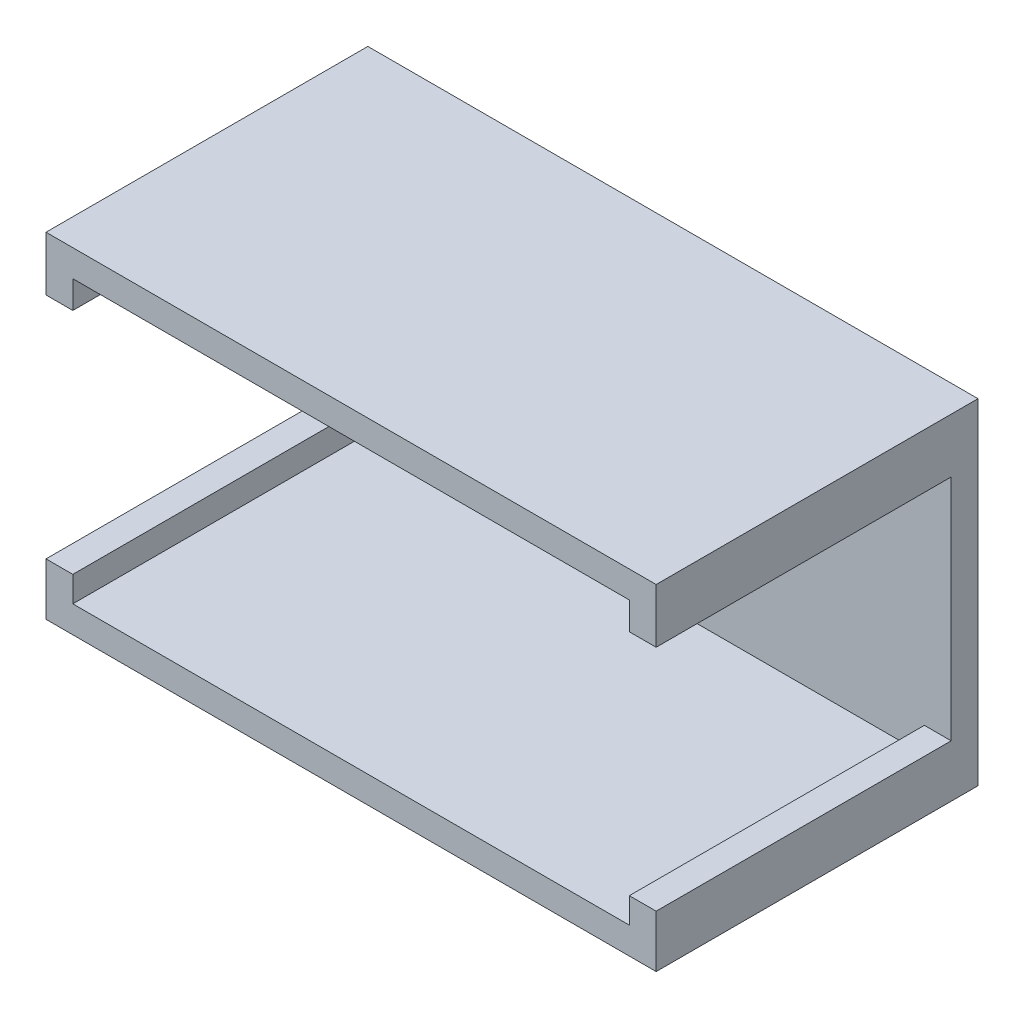
from build123d import *

# Parameters (mm, degrees)
SALIENTE_EXTRUIR1_DEPTH = 2
SALIENTE_EXTRUIR2_DEPTH = 24
CROQUIS4_W              = 26.838471133
CROQUIS4_H              = 17.040828642
CORTAR_EXTRUIR1_DEPTH   = 70.1
SALIENTE_EXTRUIR3_DEPTH = 2
SALIENTE_EXTRUIR4_DEPTH = 2
CROQUIS7_W              = 45.5
CROQUIS7_H              = 2
SALIENTE_EXTRUIR5_DEPTH = 8
SALIENTE_EXTRUIR6_DEPTH = 6
CROQUIS9_W              = 76.962380363
CROQUIS9_H              = 58.957858246
CORTAR_EXTRUIR2_DEPTH   = 28


with BuildPart() as part:
    # Croquis1 → Saliente-Extruir1 (new body)
    with BuildSketch(Plane.XY):
        Polygon((-48.939551095, 26.503456625), (-8.439551095, 26.503456625), (-4.439551095, 26.503456625), (-4.439551095, 1.503456625), (-8.439551095, 1.503456625), (-49.939551095, 1.503456625), (-49.939551095, 5.503456625), (-49.939551095, 26.503456625), align=None)
    extrude(amount=SALIENTE_EXTRUIR1_DEPTH)

    # Croquis3 → Saliente-Extruir2 (add)
    with BuildSketch(Plane.XY):
        Polygon((-48.939551095, 26.503456625), (-8.439551095, 26.503456625), (-4.439551095, 26.503456625), (-4.439551095, 1.503456625), (-49.939551095, 1.503456625), (-49.939551095, 26.503456625), align=None)
        Polygon((-10.439551095, 3.503456625), (-47.939551095, 3.503456625), (-47.939551095, 5.503456625), (-47.939551095, 24.503456625), (-10.439551095, 24.503456625), (-6.439551095, 24.503456625), (-6.439551095, 3.503456625), align=None, mode=Mode.SUBTRACT)
    extrude(amount=SALIENTE_EXTRUIR2_DEPTH)

    # Croquis4 → Cortar-Extruir1 (cut)
    with BuildSketch(Plane(origin=(0, 0, 0), x_dir=(0, 0, -1), z_dir=(1, 0, 0))):
        with Locations((-15.419235567, 13.92807924)):
            Rectangle(CROQUIS4_W, CROQUIS4_H)
    extrude(amount=-CORTAR_EXTRUIR1_DEPTH, mode=Mode.SUBTRACT)

    # Croquis5 → Saliente-Extruir3 (add)
    with BuildSketch(Plane(origin=(0, 26.503456625, 0), x_dir=(1, 0, 0), z_dir=(0, 1, 0))):
        Polygon((-49.939551095, -20.607192887), (-4.439551095, -20.607192887), (-4.439551095, -36.1), (-8.439551095, -36.1), (-48.939551095, -36.1), (-49.939551095, -36.1), align=None)
    extrude(amount=-SALIENTE_EXTRUIR3_DEPTH)

    # Croquis6 → Saliente-Extruir4 (add)
    with BuildSketch(Plane.XY.offset(36.1)):
        Polygon((-4.439551095, 24.503456625), (-49.939551095, 24.503456625), (-49.939551095, 33.503456625), (-48.939551095, 33.503456625), (-8.439551095, 33.503456625), (-4.439551095, 33.503456625), align=None)
    extrude(amount=-SALIENTE_EXTRUIR4_DEPTH)

    # Croquis7 → Saliente-Extruir5 (add)
    with BuildSketch(Plane.XY.offset(36.1)):
        with Locations((-27.189551095, 32.503456625)):
            Rectangle(CROQUIS7_W, CROQUIS7_H)
    extrude(amount=-SALIENTE_EXTRUIR5_DEPTH)

    # Croquis8 → Saliente-Extruir6 (add)
    with BuildSketch(Plane.XY.offset(36.1)):
        Polygon((-49.939551095, 29.503456625), (-49.939551095, 26.503456625), (-49.715027183, 26.503456625), (-8.439551095, 26.503456625), (-4.439551095, 26.503456625), (-4.439551095, 29.503456625), (-8.439551095, 29.503456625), (-49.715027183, 29.503456625), align=None)
    extrude(amount=-SALIENTE_EXTRUIR6_DEPTH)

    # Croquis9 → Cortar-Extruir2 (cut)
    with BuildSketch(Plane.XY.offset(24)):
        with Locations((-25.38769132, 23.863692023)):
            Rectangle(CROQUIS9_W, CROQUIS9_H)
    extrude(amount=CORTAR_EXTRUIR2_DEPTH, mode=Mode.SUBTRACT)


solid = part.part
